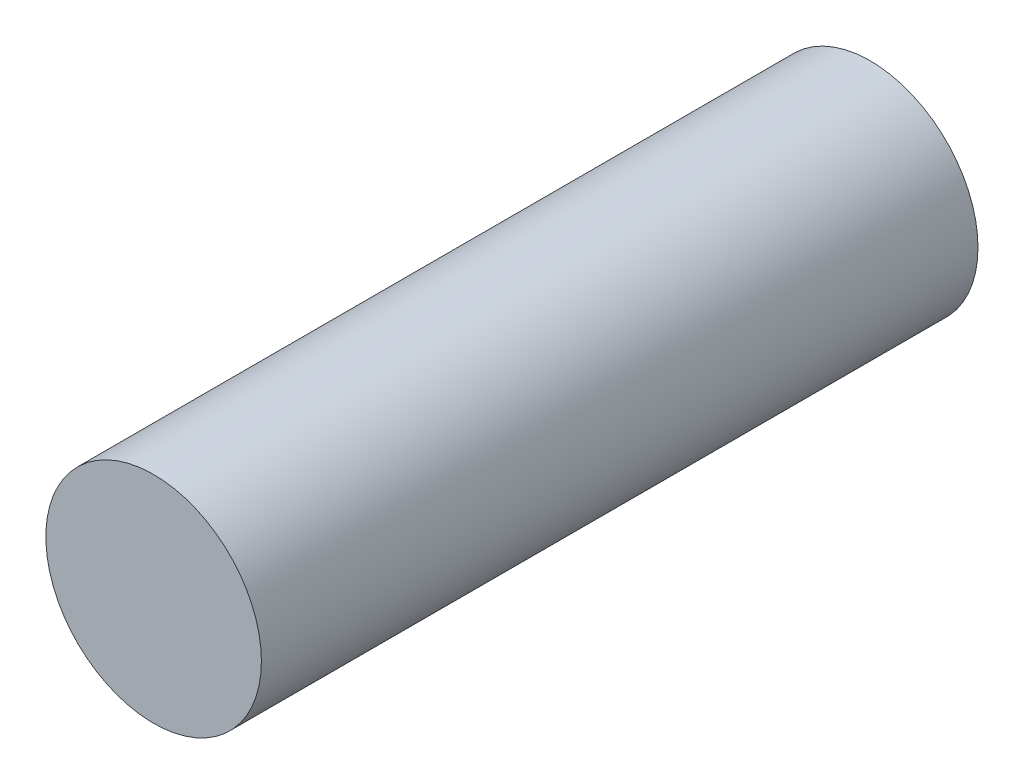
from build123d import *

# Parameters (mm, degrees)
CROQUIS1_R              = 37
SALIENTE_EXTRUIR1_DEPTH = 246


with BuildPart() as part:
    # Croquis1 → Saliente-Extruir1 (new body)
    with BuildSketch(Plane.XY):
        Circle(CROQUIS1_R)
    extrude(amount=SALIENTE_EXTRUIR1_DEPTH)


solid = part.part
